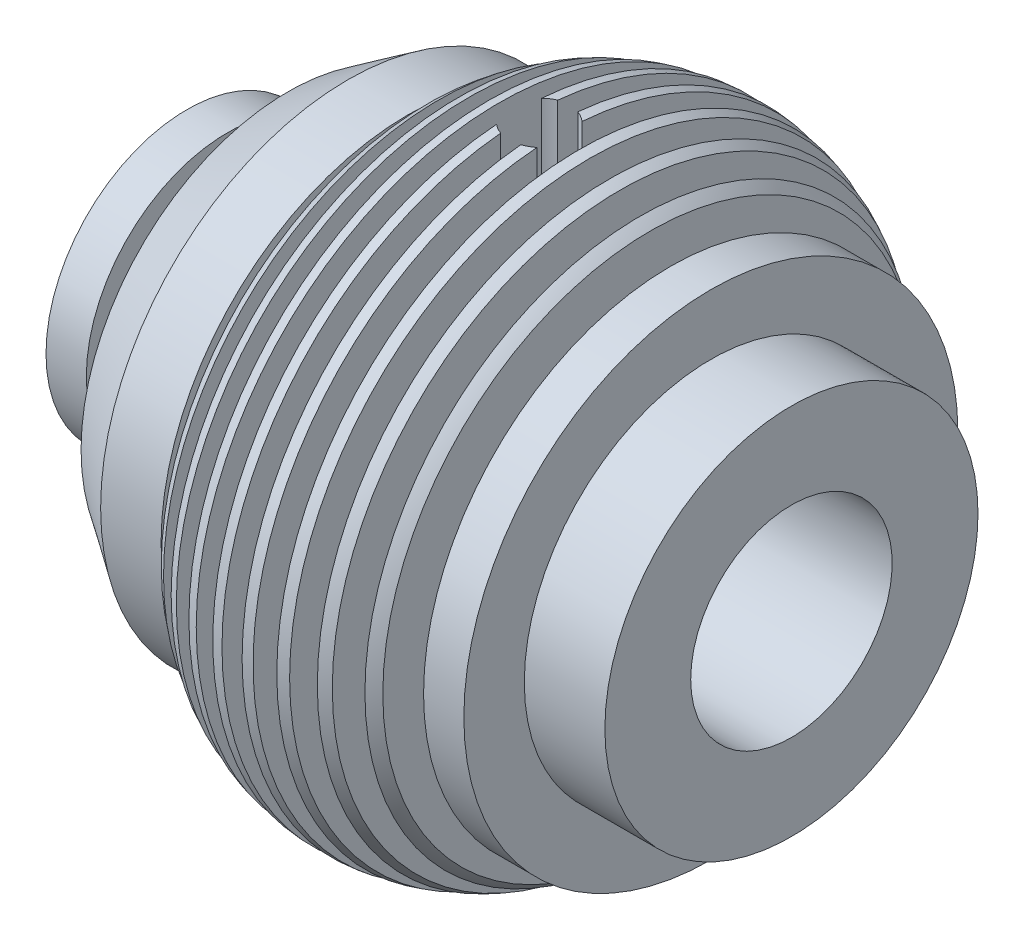
from build123d import *

# Parameters (mm, degrees)
CUT_EXTRUDE1_DEPTH      = 4693.472480102
CUT_EXTRUDE1_DEPTH_BACK = 4693.472480102
SKETCH6_R               = 190.5
SKETCH3_R               = 63.5
CUT_EXTRUDE2_DEPTH      = 457.2
SKETCH8_R               = 63.5
CUT_EXTRUDE3_DEPTH      = 457.2


with BuildPart() as part:
    # Sketch2 → Revolve1 (revolve)
    with BuildSketch(Plane.XY, mode=Mode.PRIVATE) as revolve1_sk:
        with BuildLine():
            Line((0, 381), (0, 889))
            Line((0, 889), (254, 889))
            Line((254, 889), (254, 635))
            Line((254, 635), (508, 635))
            ThreePointArc((508, 635), (597.802561211, 672.197438789), (635, 762))
            Line((635, 762), (635, 1303.02))
            Line((635, 1303.02), (1014.035978172, 1558.682995467))
            Line((1014.035978172, 1558.682995467), (1395.035978172, 1558.682995467))
            Line((1395.035978172, 1558.682995467), (1395.035978172, 1177.682995467))
            Line((1395.035978172, 1177.682995467), (1522.035978172, 1177.682995467))
            Line((1522.035978172, 1177.682995467), (1522.035978172, 1684.420240709))
            ThreePointArc((1522.035978172, 1684.420240709), (1553.328903255, 1709.705335809), (1585.535978172, 1733.815240824))
            Line((1585.535978172, 1733.815240824), (1585.535978172, 1177.682995467))
            Line((1585.535978172, 1177.682995467), (1712.535978172, 1177.682995467))
            Line((1712.535978172, 1177.682995467), (1712.535978172, 1812.608634678))
            ThreePointArc((1712.535978172, 1812.608634678), (1744.034152262, 1828.618680747), (1776.035978172, 1843.59665406))
            Line((1776.035978172, 1843.59665406), (1776.035978172, 1177.682995467))
            Line((1776.035978172, 1177.682995467), (1903.035978172, 1177.682995467))
            Line((1903.035978172, 1177.682995467), (1903.035978172, 1891.264697959))
            ThreePointArc((1903.035978172, 1891.264697959), (1934.654823673, 1900.408143402), (1966.535978172, 1908.590195292))
            Line((1966.535978172, 1908.590195292), (1966.535978172, 1177.682995467))
            Line((1966.535978172, 1177.682995467), (2093.535978172, 1177.682995467))
            Line((2093.535978172, 1177.682995467), (2093.535978172, 1931.26909618))
            ThreePointArc((2093.535978172, 1931.26909618), (2125.244896073, 1934.536446265), (2157.035978172, 1936.87271466))
            Line((2157.035978172, 1936.87271466), (2157.035978172, 1177.682995467))
            Line((2157.035978172, 1177.682995467), (2284.035978172, 1177.682995467))
            Line((2284.035978172, 1177.682995467), (2284.035978172, 1936.904485995))
            ThreePointArc((2284.035978172, 1936.904485995), (2315.82682313, 1934.584247133), (2347.535978172, 1931.332967697))
            Line((2347.535978172, 1931.332967697), (2347.535978172, 1177.682995467))
            Line((2347.535978172, 1177.682995467), (2474.535978172, 1177.682995467))
            Line((2474.535978172, 1177.682995467), (2474.535978172, 1908.720675065))
            ThreePointArc((2474.535978172, 1908.720675065), (2506.416846699, 1900.556222782), (2538.035978172, 1891.430512729))
            Line((2538.035978172, 1891.430512729), (2538.035978172, 1177.682995467))
            Line((2538.035978172, 1177.682995467), (2665.035978172, 1177.682995467))
            Line((2665.035978172, 1177.682995467), (2665.035978172, 1843.839939553))
            ThreePointArc((2665.035978172, 1843.839939553), (2697.037380618, 1828.883682805), (2728.535978172, 1812.895633314))
            Line((2728.535978172, 1812.895633314), (2728.535978172, 1177.682995467))
            Line((2728.535978172, 1177.682995467), (2855.535978172, 1177.682995467))
            Line((2855.535978172, 1177.682995467), (2855.535978172, 1734.206002761))
            ThreePointArc((2855.535978172, 1734.206002761), (2887.74223087, 1710.12808183), (2919.035978172, 1684.875549899))
            Line((2919.035978172, 1684.875549899), (2919.035978172, 1177.682995467))
            Line((2919.035978172, 1177.682995467), (3048, 1176.02))
            Line((3048, 1176.02), (3048, 1557.02))
            Line((3048, 1557.02), (3302, 1557.02))
            Line((3302, 1557.02), (3302, 1176.02))
            Line((3302, 1176.02), (3810, 1176.02))
            Line((3810, 1176.02), (3810, 635))
            Line((3810, 635), (1270, 635))
            Line((1270, 635), (1270, 381))
            Line((1270, 381), (0, 381))
        make_face()
    revolve(revolve1_sk.sketch.rotate(Axis((0, 0, 0), (1, 0, 0)), 90), axis=Axis((0, 0, 0), (1, 0, 0)))

    # Sketch6 → Cut-Extrude1 (cut, two sides: drawn at the far end of the back side and taken through both)
    with BuildSketch(Plane(origin=(0, 0, 0), x_dir=(1, 0, 0), z_dir=(0, 1, 0)).offset(-CUT_EXTRUDE1_DEPTH_BACK)):
        with Locations(Location((2220.535978172, 0, 0), (0, 0, 270))):
            Circle(SKETCH6_R)
    extrude(amount=CUT_EXTRUDE1_DEPTH + CUT_EXTRUDE1_DEPTH_BACK, mode=Mode.SUBTRACT)

    # Sketch3 → Cut-Extrude2 (cut)
    with BuildSketch(Plane.ZY.offset(-635)):
        with Locations((-1032.51, 0)):
            Circle(SKETCH3_R)
    extrude(amount=-CUT_EXTRUDE2_DEPTH, mode=Mode.SUBTRACT)

    # Sketch8 → Cut-Extrude3 (cut)
    with BuildSketch(Plane.ZY.offset(-635)):
        with Locations((1032.51, 0)):
            Circle(SKETCH8_R)
        with Locations((0, 1032.51)):
            Circle(SKETCH8_R)
        with Locations((0, -1032.51)):
            Circle(SKETCH8_R)
        with Locations((-1032.51, 0)):
            Circle(SKETCH8_R)
    extrude(amount=-CUT_EXTRUDE3_DEPTH, mode=Mode.SUBTRACT)


solid = part.part
